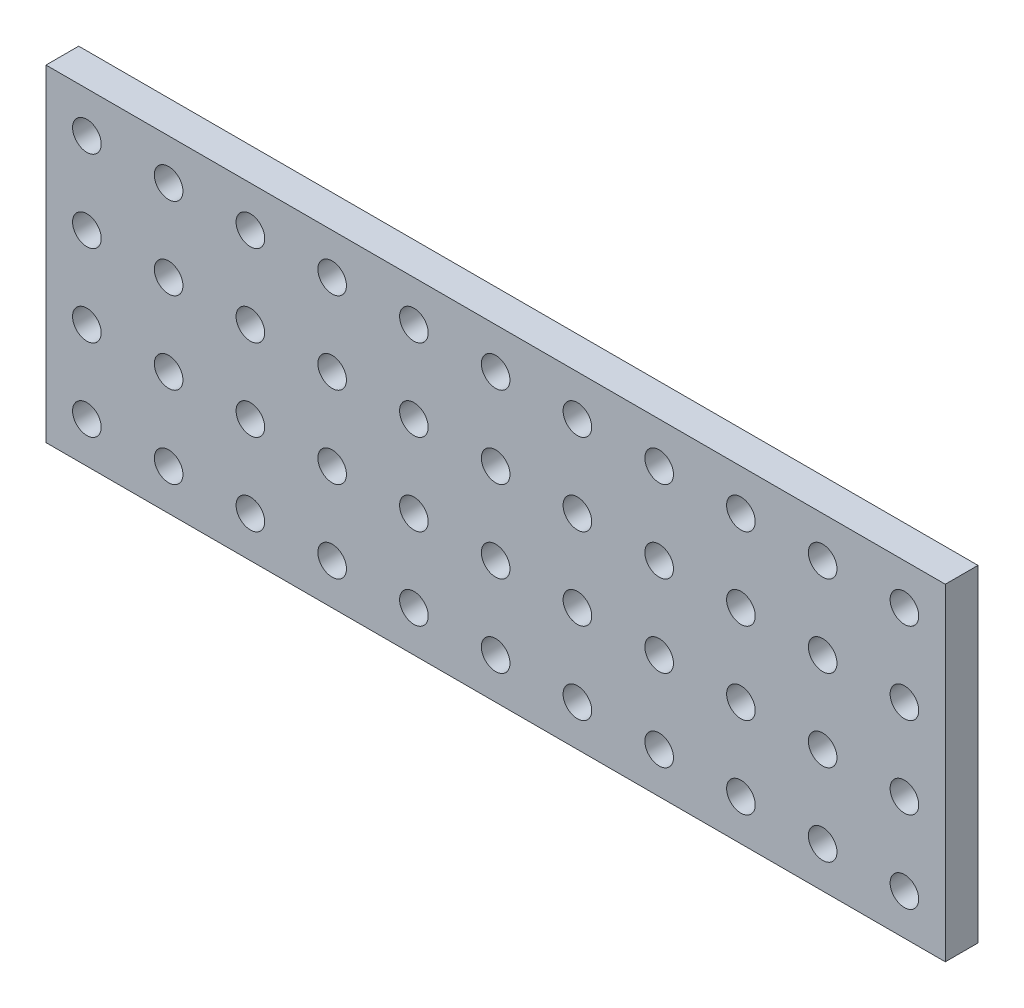
from build123d import *

# Parameters (mm, degrees)
ESQUISSE1_W        = 110
ESQUISSE1_H        = 40
ESQUISSE1_R        = 1.75
BOSS_EXTRU_1_DEPTH = 4


with BuildPart() as part:
    # Esquisse1 → Boss.-Extru.1 (new body)
    with BuildSketch(Plane.XY):
        with Locations((55, -20)):
            Rectangle(ESQUISSE1_W, ESQUISSE1_H)
        with Locations((5, -5)):
            Circle(ESQUISSE1_R, mode=Mode.SUBTRACT)
        with Locations((15, -5)):
            Circle(ESQUISSE1_R, mode=Mode.SUBTRACT)
        with Locations((25, -5)):
            Circle(ESQUISSE1_R, mode=Mode.SUBTRACT)
        with Locations((35, -5)):
            Circle(ESQUISSE1_R, mode=Mode.SUBTRACT)
        with Locations((45, -5)):
            Circle(ESQUISSE1_R, mode=Mode.SUBTRACT)
        with Locations((55, -5)):
            Circle(ESQUISSE1_R, mode=Mode.SUBTRACT)
        with Locations((65, -5)):
            Circle(ESQUISSE1_R, mode=Mode.SUBTRACT)
        with Locations((75, -5)):
            Circle(ESQUISSE1_R, mode=Mode.SUBTRACT)
        with Locations((85, -5)):
            Circle(ESQUISSE1_R, mode=Mode.SUBTRACT)
        with Locations((95, -5)):
            Circle(ESQUISSE1_R, mode=Mode.SUBTRACT)
        with Locations((105, -5)):
            Circle(ESQUISSE1_R, mode=Mode.SUBTRACT)
        with Locations((15, -15)):
            Circle(ESQUISSE1_R, mode=Mode.SUBTRACT)
        with Locations((25, -15)):
            Circle(ESQUISSE1_R, mode=Mode.SUBTRACT)
        with Locations((35, -15)):
            Circle(ESQUISSE1_R, mode=Mode.SUBTRACT)
        with Locations((45, -15)):
            Circle(ESQUISSE1_R, mode=Mode.SUBTRACT)
        with Locations((55, -15)):
            Circle(ESQUISSE1_R, mode=Mode.SUBTRACT)
        with Locations((65, -15)):
            Circle(ESQUISSE1_R, mode=Mode.SUBTRACT)
        with Locations((75, -15)):
            Circle(ESQUISSE1_R, mode=Mode.SUBTRACT)
        with Locations((85, -15)):
            Circle(ESQUISSE1_R, mode=Mode.SUBTRACT)
        with Locations((95, -15)):
            Circle(ESQUISSE1_R, mode=Mode.SUBTRACT)
        with Locations((105, -15)):
            Circle(ESQUISSE1_R, mode=Mode.SUBTRACT)
        with Locations((15, -25)):
            Circle(ESQUISSE1_R, mode=Mode.SUBTRACT)
        with Locations((25, -25)):
            Circle(ESQUISSE1_R, mode=Mode.SUBTRACT)
        with Locations((35, -25)):
            Circle(ESQUISSE1_R, mode=Mode.SUBTRACT)
        with Locations((45, -25)):
            Circle(ESQUISSE1_R, mode=Mode.SUBTRACT)
        with Locations((55, -25)):
            Circle(ESQUISSE1_R, mode=Mode.SUBTRACT)
        with Locations((65, -25)):
            Circle(ESQUISSE1_R, mode=Mode.SUBTRACT)
        with Locations((75, -25)):
            Circle(ESQUISSE1_R, mode=Mode.SUBTRACT)
        with Locations((85, -25)):
            Circle(ESQUISSE1_R, mode=Mode.SUBTRACT)
        with Locations((95, -25)):
            Circle(ESQUISSE1_R, mode=Mode.SUBTRACT)
        with Locations((105, -25)):
            Circle(ESQUISSE1_R, mode=Mode.SUBTRACT)
        with Locations((15, -35)):
            Circle(ESQUISSE1_R, mode=Mode.SUBTRACT)
        with Locations((25, -35)):
            Circle(ESQUISSE1_R, mode=Mode.SUBTRACT)
        with Locations((35, -35)):
            Circle(ESQUISSE1_R, mode=Mode.SUBTRACT)
        with Locations((45, -35)):
            Circle(ESQUISSE1_R, mode=Mode.SUBTRACT)
        with Locations((55, -35)):
            Circle(ESQUISSE1_R, mode=Mode.SUBTRACT)
        with Locations((65, -35)):
            Circle(ESQUISSE1_R, mode=Mode.SUBTRACT)
        with Locations((75, -35)):
            Circle(ESQUISSE1_R, mode=Mode.SUBTRACT)
        with Locations((85, -35)):
            Circle(ESQUISSE1_R, mode=Mode.SUBTRACT)
        with Locations((95, -35)):
            Circle(ESQUISSE1_R, mode=Mode.SUBTRACT)
        with Locations((105, -35)):
            Circle(ESQUISSE1_R, mode=Mode.SUBTRACT)
        with Locations((5, -15)):
            Circle(ESQUISSE1_R, mode=Mode.SUBTRACT)
        with Locations((5, -25)):
            Circle(ESQUISSE1_R, mode=Mode.SUBTRACT)
        with Locations((5, -35)):
            Circle(ESQUISSE1_R, mode=Mode.SUBTRACT)
    extrude(amount=BOSS_EXTRU_1_DEPTH)


solid = part.part
